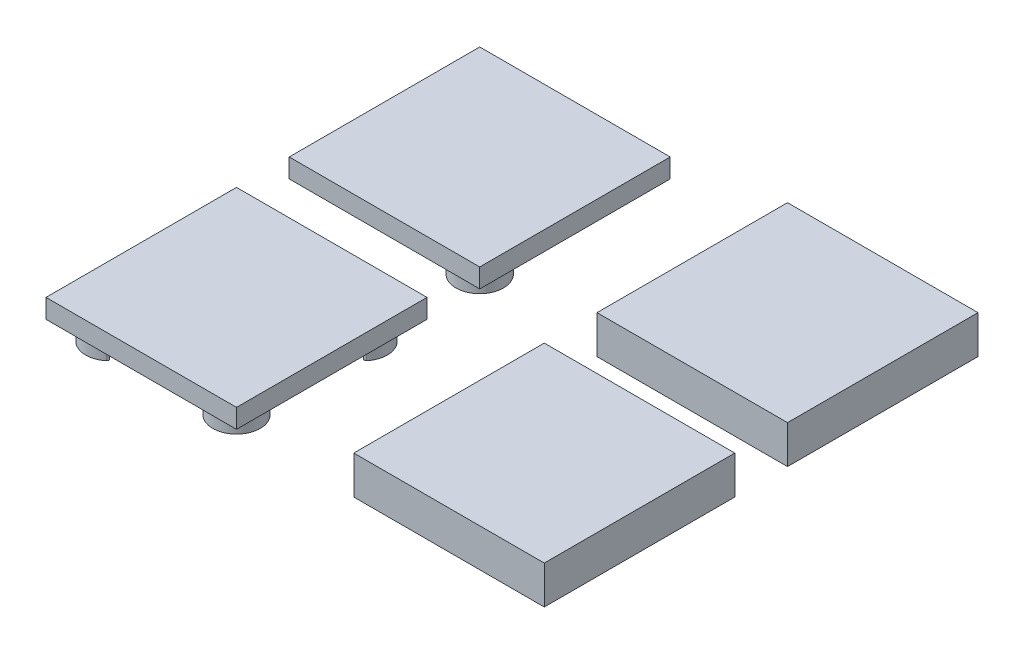
from build123d import *

# Parameters (mm, degrees)
SKETCH3_W           = 30
SKETCH3_H           = 30
BOSS_EXTRUDE1_DEPTH = 3
BOSS_EXTRUDE2_DEPTH = 6
SKETCH5_W           = 30
SKETCH5_H           = 30
BOSS_EXTRUDE4_DEPTH = 6
FILLET3_R           = 0.3
CUT_EXTRUDE2_START  = -3
CUT_EXTRUDE2_DEPTH  = 3
SKETCH17_W          = 30
SKETCH17_H          = 30
BOSS_EXTRUDE6_DEPTH = 3
BOSS_EXTRUDE7_DEPTH = 6
SKETCH20_W          = 30
SKETCH20_H          = 30
BOSS_EXTRUDE8_DEPTH = 6
CUT_EXTRUDE3_START  = -3
CUT_EXTRUDE3_DEPTH  = 3
FILLET4_R           = 0.3
FILLET5_R           = 0.3
FILLET6_R           = 0.3


with BuildPart() as part:
    # Sketch3 → Boss-Extrude1 (new body)
    with BuildSketch(Plane(origin=(0, 0, 0), x_dir=(1, 0, 0), z_dir=(0, 1, 0))):
        Rectangle(SKETCH3_W, SKETCH3_H)
    extrude(amount=BOSS_EXTRUDE1_DEPTH)

    # Sketch1 → Boss-Extrude2 (add)
    with BuildSketch(Plane(origin=(0, 3, 0), x_dir=(1, 0, 0), z_dir=(0, 1, 0))):
        with BuildLine():
            Line((-12.651650429, 7.348349571), (-7.348349571, 12.651650429))
            ThreePointArc((-7.348349571, 12.651650429), (-12.651650429, 12.651650429), (-12.651650429, 7.348349571))
        make_face()
        with BuildLine():
            Line((7.348349571, -12.651650429), (12.651650429, -7.348349571))
            ThreePointArc((12.651650429, -7.348349571), (12.651650429, -12.651650429), (7.348349571, -12.651650429))
        make_face()
    extrude(amount=-BOSS_EXTRUDE2_DEPTH)

    # Fillet3
    fillet3_edges = [part.edges().sort_by_distance(p)[0] for p in [
        (-12.651650429, -1.5, -7.348349571),
        (-7.348349571, -1.5, -12.651650429),
        (12.651650429, -1.5, 7.348349571),
        (7.348349571, -1.5, 12.651650429),
    ]]
    fillet(fillet3_edges, radius=FILLET3_R)


with BuildPart() as body_2:
    # Sketch5 → Boss-Extrude4 (new body)
    with BuildSketch(Plane(origin=(0, 0, 0), x_dir=(1, 0, 0), z_dir=(0, 1, 0))):
        with Locations((48.465823931, 0)):
            Rectangle(SKETCH5_W, SKETCH5_H)
    extrude(amount=BOSS_EXTRUDE4_DEPTH)

    # Sketch16 → Cut-Extrude2 (cut)
    with BuildSketch(Plane(origin=(0, 6, 0), x_dir=(1, 0, 0), z_dir=(0, 1, 0)).offset(CUT_EXTRUDE2_START)):
        with BuildLine():
            Line((35.815091977, 7.20784669), (41.257977241, 12.650731954))
            ThreePointArc((41.257977241, 12.650731954), (35.743462823, 12.722361108), (35.815091977, 7.20784669))
        make_face()
        with BuildLine():
            Line((55.67367062, -12.650731954), (61.116555885, -7.20784669))
            ThreePointArc((61.116555885, -7.20784669), (61.188185038, -12.722361108), (55.67367062, -12.650731954))
        make_face()
    extrude(amount=-CUT_EXTRUDE2_DEPTH, mode=Mode.SUBTRACT)

    # Fillet4
    fillet4_edges = [body_2.edges().sort_by_distance(p)[0] for p in [
        (35.815091977, 1.5, -7.20784669),
        (41.257977241, 1.5, -12.650731954),
        (61.116555885, 1.5, 7.20784669),
        (55.67367062, 1.5, 12.650731954),
    ]]
    fillet(fillet4_edges, radius=FILLET4_R)


with BuildPart() as body_3:
    # Sketch17 → Boss-Extrude6 (new body)
    with BuildSketch(Plane(origin=(0, 0, 0), x_dir=(1, 0, 0), z_dir=(0, 1, 0))):
        with Locations((0, -38.300792551)):
            Rectangle(SKETCH17_W, SKETCH17_H)
    extrude(amount=BOSS_EXTRUDE6_DEPTH)

    # Sketch19 → Boss-Extrude7 (add)
    with BuildSketch(Plane(origin=(0, 3, 0), x_dir=(1, 0, 0), z_dir=(0, 1, 0))):
        with BuildLine():
            Line((12.651650429, -30.952442981), (7.348349571, -25.649142122))
            ThreePointArc((7.348349571, -25.649142122), (12.651650429, -25.649142122), (12.651650429, -30.952442981))
        make_face()
        with BuildLine():
            Line((7.348349571, -50.952442981), (12.651650429, -45.649142122))
            ThreePointArc((12.651650429, -45.649142122), (12.651650429, -50.952442981), (7.348349571, -50.952442981))
        make_face()
        with BuildLine():
            ThreePointArc((-7.348349571, -50.952442981), (-12.651650429, -50.952442981), (-12.651650429, -45.649142122))
            Line((-12.651650429, -45.649142122), (-7.348349571, -50.952442981))
        make_face()
        with BuildLine():
            Line((-12.651650429, -30.952442981), (-7.348349571, -25.649142122))
            ThreePointArc((-7.348349571, -25.649142122), (-12.651650429, -25.649142122), (-12.651650429, -30.952442981))
        make_face()
    extrude(amount=-BOSS_EXTRUDE7_DEPTH)

    # Fillet5
    fillet5_edges = [body_3.edges().sort_by_distance(p)[0] for p in [
        (12.651650429, -1.5, 30.952442981),
        (7.348349571, -1.5, 25.649142122),
        (7.348349571, -1.5, 50.952442981),
        (12.651650429, -1.5, 45.649142122),
        (-7.348349571, -1.5, 50.952442981),
        (-12.651650429, -1.5, 45.649142122),
        (-7.348349571, -1.5, 25.649142122),
        (-12.651650429, -1.5, 30.952442981),
    ]]
    fillet(fillet5_edges, radius=FILLET5_R)


with BuildPart() as body_4:
    # Sketch20 → Boss-Extrude8 (new body)
    with BuildSketch(Plane(origin=(0, 0, 0), x_dir=(1, 0, 0), z_dir=(0, 1, 0))):
        with Locations((48.465823931, -38.300792551)):
            Rectangle(SKETCH20_W, SKETCH20_H)
    extrude(amount=BOSS_EXTRUDE8_DEPTH)

    # Sketch21 → Cut-Extrude3 (cut)
    with BuildSketch(Plane(origin=(0, 6, 0), x_dir=(1, 0, 0), z_dir=(0, 1, 0)).offset(CUT_EXTRUDE3_START)):
        with BuildLine():
            Line((55.127936444, -50.931573257), (61.096604637, -44.962905064))
            ThreePointArc((61.096604637, -44.962905064), (61.471027751, -51.305996371), (55.127936444, -50.931573257))
        make_face()
        with BuildLine():
            Line((61.096604637, -31.638680038), (55.127936444, -25.670011845))
            ThreePointArc((55.127936444, -25.670011845), (61.471027751, -25.295588731), (61.096604637, -31.638680038))
        make_face()
        with BuildLine():
            Line((41.803711418, -50.931573257), (35.835043225, -44.962905064))
            ThreePointArc((35.835043225, -44.962905064), (35.460620111, -51.305996371), (41.803711418, -50.931573257))
        make_face()
        with BuildLine():
            Line((35.835043225, -31.638680038), (41.803711418, -25.670011845))
            ThreePointArc((41.803711418, -25.670011845), (35.460620111, -25.295588731), (35.835043225, -31.638680038))
        make_face()
    extrude(amount=-CUT_EXTRUDE3_DEPTH, mode=Mode.SUBTRACT)

    # Fillet6
    fillet6_edges = [body_4.edges().sort_by_distance(p)[0] for p in [
        (35.835043225, 1.5, 31.638680038),
        (41.803711418, 1.5, 25.670011845),
        (41.803711418, 1.5, 50.931573257),
        (35.835043225, 1.5, 44.962905064),
        (55.127936444, 1.5, 50.931573257),
        (61.096604637, 1.5, 44.962905064),
        (55.127936444, 1.5, 25.670011845),
        (61.096604637, 1.5, 31.638680038),
    ]]
    fillet(fillet6_edges, radius=FILLET6_R)


solid = Compound([part.part, body_2.part, body_3.part, body_4.part])
